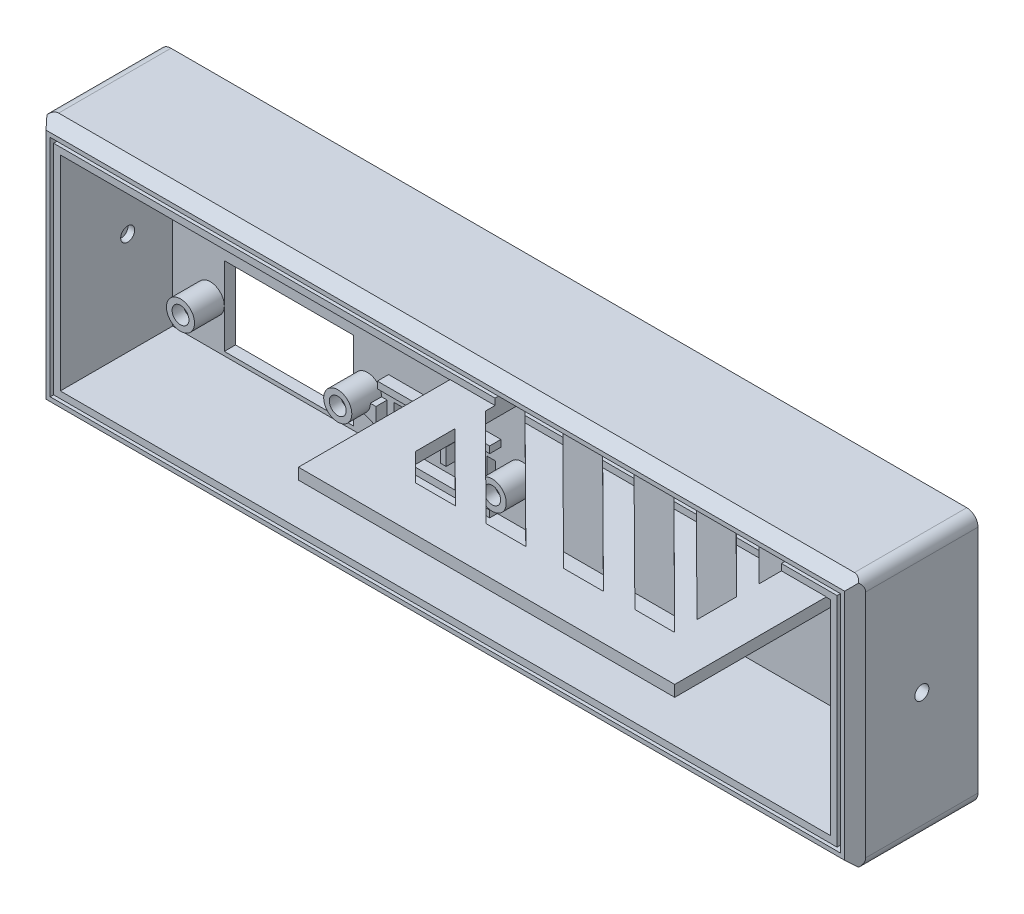
from build123d import *

# Parameters (mm, degrees)
SKETCH1_W                = 145.7
SKETCH1_H                = 45
BOSS_EXTRUDE1_DEPTH      = 2
USB_REACH                = 154.504
SKETCH2_W                = 15
SKETCH2_H                = 6.9
SKETCH3_W                = 15
SKETCH3_H                = 8.4
USB_BACK_DEPTH           = 1
USB_BACK_SUPPORT_DEPTH   = 8
SKETCH5_W                = 17.4
SKETCH5_H                = 3
USB_BACK_SUPPORT_2_DEPTH = 1.5
VOLTMETER_HOLE_REACH     = 154.924
SKETCH6_W                = 23
SKETCH6_H                = 14
SKETCH7_R                = 2.5
VOLTMETER_PLOT_DEPTH     = 5.3
SKETCH10_R               = 1.5
PLOT_HOLE_DEPTH          = 2
SKETCH8_W                = 67
SKETCH8_H                = 2
BOSS_EXTRUDE5_DEPTH      = 47
DC_REACH                 = 162.17
SKETCH9_W                = 7
SKETCH9_H                = 9.5
SKETCH9_W_2              = 9
SKETCH9_H_2              = 11
SWITCH_HOLA_REACH        = 162.17
SKETCH11_W               = 1.5
SKETCH11_H               = 3.5
SKETCH12_W               = 20
SKETCH12_H               = 1.2
SKETCH12_W_2             = 1
SKETCH12_H_2             = 3
SWITCH_BLOCK_DEPTH       = 2
TROU_ROULETTE_REACH      = 161.57
SKETCH15_W               = 7.5
SKETCH15_H               = 2
SKETCH16_W               = 8.5
SKETCH16_H               = 2
CUT_EXTRUDE2_DEPTH       = 0.5
SKETCH17_W               = 145.7
SKETCH17_H               = 45
SKETCH17_W_2             = 140.7
SKETCH17_H_2             = 40
SKETCH17_W_3             = 139.5
SKETCH17_H_3             = 38.8
SKETCH17_W_4             = 137.1
SKETCH17_H_4             = 36.4
BORD_DEPTH               = 20
FILLET1_R                = 2
CUT_EXTRUDE3_REACH       = 160.528
CUT_EXTRUDE4_REACH       = 162.17
CUT_EXTRUDE5_REACH       = 162.17
CUT_EXTRUDE6_REACH       = 162.17
SKETCH21_R               = 1.25


with BuildPart() as part:
    # Sketch1 → Boss-Extrude1 (new body)
    with BuildSketch(Plane.XY):
        with Locations((72.85, 22.5)):
            Rectangle(SKETCH1_W, SKETCH1_H)
    extrude(amount=BOSS_EXTRUDE1_DEPTH)

    # Sketch2 → usb (cut, up to next)
    with BuildSketch(Plane(origin=(0, 0, 0), x_dir=(-1, 0, 0), z_dir=(0, 0, -1)), mode=Mode.PRIVATE) as usb_sk1:
        with Locations((-37.5, 35.55)):
            Rectangle(SKETCH2_W, SKETCH2_H)
    usb_tool1 = extrude(usb_sk1.sketch, amount=-USB_REACH, mode=Mode.PRIVATE) & part.part
    # Sketch2 → usb (cut, up to next)
    with BuildSketch(Plane(origin=(0, 0, 0), x_dir=(-1, 0, 0), z_dir=(0, 0, -1)), mode=Mode.PRIVATE) as usb_sk2:
        with Locations((-57.5, 35.55)):
            Rectangle(SKETCH2_W, SKETCH2_H)
    usb_tool2 = extrude(usb_sk2.sketch, amount=-USB_REACH, mode=Mode.PRIVATE) & part.part
    add(usb_tool1.solids().sort_by_distance((37.5, 35.55, 0))[0], mode=Mode.SUBTRACT)
    add(usb_tool2.solids().sort_by_distance((57.5, 35.55, 0))[0], mode=Mode.SUBTRACT)

    # Sketch3 → usb_back (cut)
    with BuildSketch(Plane.XY.offset(2)):
        with Locations((37.5, 34.8)):
            Rectangle(SKETCH3_W, SKETCH3_H)
        with Locations((57.5, 34.8)):
            Rectangle(SKETCH3_W, SKETCH3_H)
    extrude(amount=-USB_BACK_DEPTH, mode=Mode.SUBTRACT)

    # Sketch4 → usb_back_support (add)
    with BuildSketch(Plane.XY.offset(2)):
        Polygon((65, 39), (65, 38), (66.2, 38), (66.2, 41), (48.8, 41), (48.8, 38), (50, 38), (50, 39), align=None)
        Polygon((45, 39), (45, 38), (46.2, 38), (46.2, 41), (28.8, 41), (28.8, 38), (30, 38), (30, 39), align=None)
    extrude(amount=USB_BACK_SUPPORT_DEPTH)

    # Sketch5 → usb_back_support_2 (add)
    with BuildSketch(Plane.XY.offset(10)):
        with Locations((37.5, 39.5)):
            Rectangle(SKETCH5_W, SKETCH5_H)
        with Locations((57.5, 39.5)):
            Rectangle(SKETCH5_W, SKETCH5_H)
    extrude(amount=USB_BACK_SUPPORT_2_DEPTH)

    # Sketch6 → voltmeter_hole (cut, up to next)
    with BuildSketch(Plane(origin=(0, 0, 0), x_dir=(-1, 0, 0), z_dir=(0, 0, -1)), mode=Mode.PRIVATE) as voltmeter_hole_sk1:
        with Locations((-25, 12)):
            Rectangle(SKETCH6_W, SKETCH6_H)
    voltmeter_hole_tool1 = extrude(voltmeter_hole_sk1.sketch, amount=-VOLTMETER_HOLE_REACH, mode=Mode.PRIVATE) & part.part
    add(voltmeter_hole_tool1.solids().sort_by_distance((25, 12, 0))[0], mode=Mode.SUBTRACT)

    # Sketch7 → voltmeter_plot (add)
    with BuildSketch(Plane.XY.offset(2)):
        with Locations(Location((66.5, 12, 0), (0, 0, 180))):
            Circle(SKETCH7_R)
        with Locations(Location((39, 12, 0), (0, 0, 180))):
            Circle(SKETCH7_R)
        with Locations((11, 12)):
            Circle(SKETCH7_R)
    extrude(amount=VOLTMETER_PLOT_DEPTH)

    # Sketch10 → plot_hole (cut)
    with BuildSketch(Plane.XY.offset(7.3)):
        with Locations((66.5, 12)):
            Circle(SKETCH10_R)
        with Locations((39, 12)):
            Circle(SKETCH10_R)
        with Locations((11, 12)):
            Circle(SKETCH10_R)
    extrude(amount=-PLOT_HOLE_DEPTH, mode=Mode.SUBTRACT)

    # Sketch8 → Boss-Extrude5 (add)
    with BuildSketch(Plane.XY.offset(2)):
        with Locations((107.2, 39.75)):
            Rectangle(SKETCH8_W, SKETCH8_H)
    extrude(amount=BOSS_EXTRUDE5_DEPTH)

    # Sketch9 → dc (cut, up to next)
    with BuildSketch(Plane(origin=(0, 0, 0), x_dir=(-1, 0, 0), z_dir=(0, 0, -1)), mode=Mode.PRIVATE) as dc_sk1:
        with Locations((-23.5, 35.75)):
            Rectangle(SKETCH9_W, SKETCH9_H)
    dc_tool1 = extrude(dc_sk1.sketch, amount=-DC_REACH, mode=Mode.PRIVATE) & part.part
    # Sketch9 → dc (cut, up to next)
    with BuildSketch(Plane(origin=(0, 0, 0), x_dir=(-1, 0, 0), z_dir=(0, 0, -1)), mode=Mode.PRIVATE) as dc_sk2:
        with Locations((-12.5, 35)):
            Rectangle(SKETCH9_W_2, SKETCH9_H_2)
    dc_tool2 = extrude(dc_sk2.sketch, amount=-DC_REACH, mode=Mode.PRIVATE) & part.part
    add(dc_tool1.solids().sort_by_distance((23.5, 35.75, 0))[0], mode=Mode.SUBTRACT)
    add(dc_tool2.solids().sort_by_distance((12.5, 35, 0))[0], mode=Mode.SUBTRACT)

    # Sketch11 → switch_hola (cut, up to next)
    with BuildSketch(Plane(origin=(0, 0, 0), x_dir=(-1, 0, 0), z_dir=(0, 0, -1)), mode=Mode.PRIVATE) as switch_hola_sk1:
        with Locations((-44.5, 10.5)):
            Rectangle(SKETCH11_W, SKETCH11_H)
    switch_hola_tool1 = extrude(switch_hola_sk1.sketch, amount=-SWITCH_HOLA_REACH, mode=Mode.PRIVATE) & part.part
    # Sketch11 → switch_hola (cut, up to next)
    with BuildSketch(Plane(origin=(0, 0, 0), x_dir=(-1, 0, 0), z_dir=(0, 0, -1)), mode=Mode.PRIVATE) as switch_hola_sk2:
        with Locations((-48.5, 10.5)):
            Rectangle(SKETCH11_W, SKETCH11_H)
    switch_hola_tool2 = extrude(switch_hola_sk2.sketch, amount=-SWITCH_HOLA_REACH, mode=Mode.PRIVATE) & part.part
    # Sketch11 → switch_hola (cut, up to next)
    with BuildSketch(Plane(origin=(0, 0, 0), x_dir=(-1, 0, 0), z_dir=(0, 0, -1)), mode=Mode.PRIVATE) as switch_hola_sk3:
        with Locations((-57, 10.5)):
            Rectangle(SKETCH11_W, SKETCH11_H)
    switch_hola_tool3 = extrude(switch_hola_sk3.sketch, amount=-SWITCH_HOLA_REACH, mode=Mode.PRIVATE) & part.part
    # Sketch11 → switch_hola (cut, up to next)
    with BuildSketch(Plane(origin=(0, 0, 0), x_dir=(-1, 0, 0), z_dir=(0, 0, -1)), mode=Mode.PRIVATE) as switch_hola_sk4:
        with Locations((-61, 10.5)):
            Rectangle(SKETCH11_W, SKETCH11_H)
    switch_hola_tool4 = extrude(switch_hola_sk4.sketch, amount=-SWITCH_HOLA_REACH, mode=Mode.PRIVATE) & part.part
    add(switch_hola_tool1.solids().sort_by_distance((44.5, 10.5, 0))[0], mode=Mode.SUBTRACT)
    add(switch_hola_tool2.solids().sort_by_distance((48.5, 10.5, 0))[0], mode=Mode.SUBTRACT)
    add(switch_hola_tool3.solids().sort_by_distance((57, 10.5, 0))[0], mode=Mode.SUBTRACT)
    add(switch_hola_tool4.solids().sort_by_distance((61, 10.5, 0))[0], mode=Mode.SUBTRACT)

    # Sketch12 → switch_block (add)
    with BuildSketch(Plane.XY.offset(2)):
        with Locations((52.75, 15.45)):
            Rectangle(SKETCH12_W, SKETCH12_H)
        Polygon((65.25, 12), (63, 12), (63, 9), (65.25, 9.834936491), align=None)
        with Locations((54.5, 10.5)):
            Rectangle(SKETCH12_W_2, SKETCH12_H_2)
        with Locations((51, 10.5)):
            Rectangle(SKETCH12_W_2, SKETCH12_H_2)
        Polygon((42.5, 9), (42.5, 12), (40.25, 12), (40.25, 9.834936491), align=None)
        with Locations((52.75, 5.55)):
            Rectangle(SKETCH12_W, SKETCH12_H)
    extrude(amount=SWITCH_BLOCK_DEPTH)

    # Sketch15 → trou roulette (cut, up to next)
    with BuildSketch(Plane.XY.offset(2), mode=Mode.PRIVATE) as trou_roulette_sk1:
        with Locations((50.55, 28.6)):
            Rectangle(SKETCH15_W, SKETCH15_H)
    trou_roulette_tool1 = extrude(trou_roulette_sk1.sketch, amount=-TROU_ROULETTE_REACH, mode=Mode.PRIVATE) & part.part
    add(trou_roulette_tool1.solids().sort_by_distance((50.55, 28.6, 2))[0], mode=Mode.SUBTRACT)

    # Sketch16 → Cut-Extrude2 (cut)
    with BuildSketch(Plane.XY.offset(2)):
        with Locations((50.55, 28.6)):
            Rectangle(SKETCH16_W, SKETCH16_H)
    extrude(amount=-CUT_EXTRUDE2_DEPTH, mode=Mode.SUBTRACT)

    # Sketch17 → bord (add)
    # profile 1 of 2: a face of its own
    with BuildSketch(Plane.XY.offset(2)):
        with Locations((72.85, 22.5)):
            Rectangle(SKETCH17_W, SKETCH17_H)
        with Locations((72.85, 22.5)):
            Rectangle(SKETCH17_W_2, SKETCH17_H_2, mode=Mode.SUBTRACT)
    # profile 2 of 2: a face of its own
    with BuildSketch(Plane.XY.offset(2)):
        with Locations((72.85, 22.5)):
            Rectangle(SKETCH17_W_3, SKETCH17_H_3)
        with Locations((72.85, 22.5)):
            Rectangle(SKETCH17_W_4, SKETCH17_H_4, mode=Mode.SUBTRACT)
    extrude(amount=BORD_DEPTH)

    # Fillet1
    fillet1_edges = [part.edges().sort_by_distance(p)[0] for p in [
        (0, 45, 11),
        (145.7, 45, 11),
        (145.7, 0, 11),
        (0, 0, 11),
    ]]
    fillet(fillet1_edges, radius=FILLET1_R)

    # Cut-Extrude3: up to this face of the body (flat: up to its plane)
    cut_extrude3_end = Plane(part.part.faces().sort_by_distance((72.85, 41.9, 12))[0])
    # Sketch18 → Cut-Extrude3 (cut, up to the picked face)
    with BuildSketch(Plane.XZ.offset(-38.75), mode=Mode.PRIVATE) as cut_extrude3_sk1:
        Polygon((81.7, 36.178535443), (86.554874827, 41), (93.650484366, 41), (81.7, 29.131756459), align=None)
    cut_extrude3_tool1 = split(extrude(cut_extrude3_sk1.sketch, amount=-CUT_EXTRUDE3_REACH, mode=Mode.PRIVATE), bisect_by=cut_extrude3_end, keep=Keep.BOTH, mode=Mode.PRIVATE)
    # Sketch18 → Cut-Extrude3 (cut, up to the picked face)
    with BuildSketch(Plane.XZ.offset(-38.75), mode=Mode.PRIVATE) as cut_extrude3_sk2:
        Polygon((81.7, 23.722435448), (99.09728919, 41), (106.192898729, 41), (81.7, 16.675656464), align=None)
    cut_extrude3_tool2 = split(extrude(cut_extrude3_sk2.sketch, amount=-CUT_EXTRUDE3_REACH, mode=Mode.PRIVATE), bisect_by=cut_extrude3_end, keep=Keep.BOTH, mode=Mode.PRIVATE)
    # Sketch18 → Cut-Extrude3 (cut, up to the picked face)
    with BuildSketch(Plane.XZ.offset(-38.75), mode=Mode.PRIVATE) as cut_extrude3_sk3:
        Polygon((81.7, 10), (112.91481406, 41), (120.010423599, 41), (88.795609539, 10), align=None)
    cut_extrude3_tool3 = split(extrude(cut_extrude3_sk3.sketch, amount=-CUT_EXTRUDE3_REACH, mode=Mode.PRIVATE), bisect_by=cut_extrude3_end, keep=Keep.BOTH, mode=Mode.PRIVATE)
    # Sketch18 → Cut-Extrude3 (cut, up to the picked face)
    with BuildSketch(Plane.XZ.offset(-38.75), mode=Mode.PRIVATE) as cut_extrude3_sk4:
        Polygon((94.389576401, 10), (125.604390461, 41), (132.7, 41), (101.48518594, 10), align=None)
    cut_extrude3_tool4 = split(extrude(cut_extrude3_sk4.sketch, amount=-CUT_EXTRUDE3_REACH, mode=Mode.PRIVATE), bisect_by=cut_extrude3_end, keep=Keep.BOTH, mode=Mode.PRIVATE)
    # Sketch18 → Cut-Extrude3 (cut, up to the picked face)
    with BuildSketch(Plane.XZ.offset(-38.75), mode=Mode.PRIVATE) as cut_extrude3_sk5:
        Polygon((105.479535572, 10), (132.7, 37.033138678), (132.7, 29.986359693), (112.575145111, 10), align=None)
    cut_extrude3_tool5 = split(extrude(cut_extrude3_sk5.sketch, amount=-CUT_EXTRUDE3_REACH, mode=Mode.PRIVATE), bisect_by=cut_extrude3_end, keep=Keep.BOTH, mode=Mode.PRIVATE)
    # Sketch18 → Cut-Extrude3 (cut, up to the picked face)
    with BuildSketch(Plane.XZ.offset(-38.75), mode=Mode.PRIVATE) as cut_extrude3_sk6:
        Polygon((116.602863055, 10), (132.7, 25.986359693), (132.7, 18.939580709), (123.698472594, 10), align=None)
    cut_extrude3_tool6 = split(extrude(cut_extrude3_sk6.sketch, amount=-CUT_EXTRUDE3_REACH, mode=Mode.PRIVATE), bisect_by=cut_extrude3_end, keep=Keep.BOTH, mode=Mode.PRIVATE)
    add(cut_extrude3_tool1.solids().sort_by(Axis((86.151001, 38.75, 36.57963), (0, 1, 0)))[0], mode=Mode.SUBTRACT)
    add(cut_extrude3_tool2.solids().sort_by(Axis((92.272705, 38.75, 30.500054), (0, 1, 0)))[0], mode=Mode.SUBTRACT)
    add(cut_extrude3_tool3.solids().sort_by(Axis((100.855212, 38.75, 25.5), (0, 1, 0)))[0], mode=Mode.SUBTRACT)
    add(cut_extrude3_tool4.solids().sort_by(Axis((113.544788, 38.75, 25.5), (0, 1, 0)))[0], mode=Mode.SUBTRACT)
    add(cut_extrude3_tool5.solids().sort_by(Axis((120.775052, 38.75, 21.842883), (0, 1, 0)))[0], mode=Mode.SUBTRACT)
    add(cut_extrude3_tool6.solids().sort_by(Axis((126.258168, 38.75, 16.397501), (0, 1, 0)))[0], mode=Mode.SUBTRACT)

    # Cut-Extrude4: up to this face of the body (flat: up to its plane)
    cut_extrude4_end = Plane(part.part.faces().sort_by_distance((0, 22.5, 11))[0])
    # Sketch19 → Cut-Extrude4 (cut, up to the picked face)
    with BuildSketch(Plane(origin=(145.7, 0, 0), x_dir=(0, 0, -1), z_dir=(1, 0, 0)), mode=Mode.PRIVATE) as cut_extrude4_sk1:
        Polygon((-22, 43.25), (-20, 45), (-22, 45), align=None)
    cut_extrude4_tool1 = split(extrude(cut_extrude4_sk1.sketch, amount=-CUT_EXTRUDE4_REACH, mode=Mode.PRIVATE), bisect_by=cut_extrude4_end, keep=Keep.BOTH, mode=Mode.PRIVATE)
    # Sketch19 → Cut-Extrude4 (cut, up to the picked face)
    with BuildSketch(Plane(origin=(145.7, 0, 0), x_dir=(0, 0, -1), z_dir=(1, 0, 0)), mode=Mode.PRIVATE) as cut_extrude4_sk2:
        Polygon((-22, 1.75), (-20, 0), (-22, 0), align=None)
    cut_extrude4_tool2 = split(extrude(cut_extrude4_sk2.sketch, amount=-CUT_EXTRUDE4_REACH, mode=Mode.PRIVATE), bisect_by=cut_extrude4_end, keep=Keep.BOTH, mode=Mode.PRIVATE)
    add(cut_extrude4_tool1.solids().sort_by(Axis((145.7, 44.416667, 21.333333), (-1, 0, 0)))[0], mode=Mode.SUBTRACT)
    add(cut_extrude4_tool2.solids().sort_by(Axis((145.7, 0.583333, 21.333333), (-1, 0, 0)))[0], mode=Mode.SUBTRACT)

    # Cut-Extrude5: up to this face of the body (flat: up to its plane)
    cut_extrude5_end = Plane(part.part.faces().sort_by_distance((72.85, 45, 10))[0])
    # Sketch20 → Cut-Extrude5 (cut, up to the picked face)
    with BuildSketch(Plane(origin=(0, 0, 0), x_dir=(-1, 0, 0), z_dir=(0, -1, 0)), mode=Mode.PRIVATE) as cut_extrude5_sk1:
        Polygon((-143.95, -22), (-145.7, -20), (-145.7, -22), align=None)
    cut_extrude5_tool1 = split(extrude(cut_extrude5_sk1.sketch, amount=-CUT_EXTRUDE5_REACH, mode=Mode.PRIVATE), bisect_by=cut_extrude5_end, keep=Keep.BOTH, mode=Mode.PRIVATE)
    # Sketch20 → Cut-Extrude5 (cut, up to the picked face)
    with BuildSketch(Plane(origin=(0, 0, 0), x_dir=(-1, 0, 0), z_dir=(0, -1, 0)), mode=Mode.PRIVATE) as cut_extrude5_sk2:
        Polygon((-1.75, -22), (0, -20), (0, -22), align=None)
    cut_extrude5_tool2 = split(extrude(cut_extrude5_sk2.sketch, amount=-CUT_EXTRUDE5_REACH, mode=Mode.PRIVATE), bisect_by=cut_extrude5_end, keep=Keep.BOTH, mode=Mode.PRIVATE)
    add(cut_extrude5_tool1.solids().sort_by(Axis((145.116667, 0, 21.333333), (0, 1, 0)))[0], mode=Mode.SUBTRACT)
    add(cut_extrude5_tool2.solids().sort_by(Axis((0.583333, 0, 21.333333), (0, 1, 0)))[0], mode=Mode.SUBTRACT)

    # Cut-Extrude6: up to this face of the body (flat: up to its plane)
    cut_extrude6_end = Plane(part.part.faces().sort_by_distance((145.7, 22.5, 10))[0])
    # Sketch21 → Cut-Extrude6 (cut, up to the picked face)
    with BuildSketch(Plane.ZY, mode=Mode.PRIVATE) as cut_extrude6_sk1:
        with Locations(Location((10, 22.5, 0), (0, 0, 180))):
            Circle(SKETCH21_R)
    cut_extrude6_tool1 = split(extrude(cut_extrude6_sk1.sketch, amount=-CUT_EXTRUDE6_REACH, mode=Mode.PRIVATE), bisect_by=cut_extrude6_end, keep=Keep.BOTH, mode=Mode.PRIVATE)
    add(cut_extrude6_tool1.solids().sort_by(Axis((0, 22.5, 10), (1, 0, 0)))[0], mode=Mode.SUBTRACT)


solid = part.part
